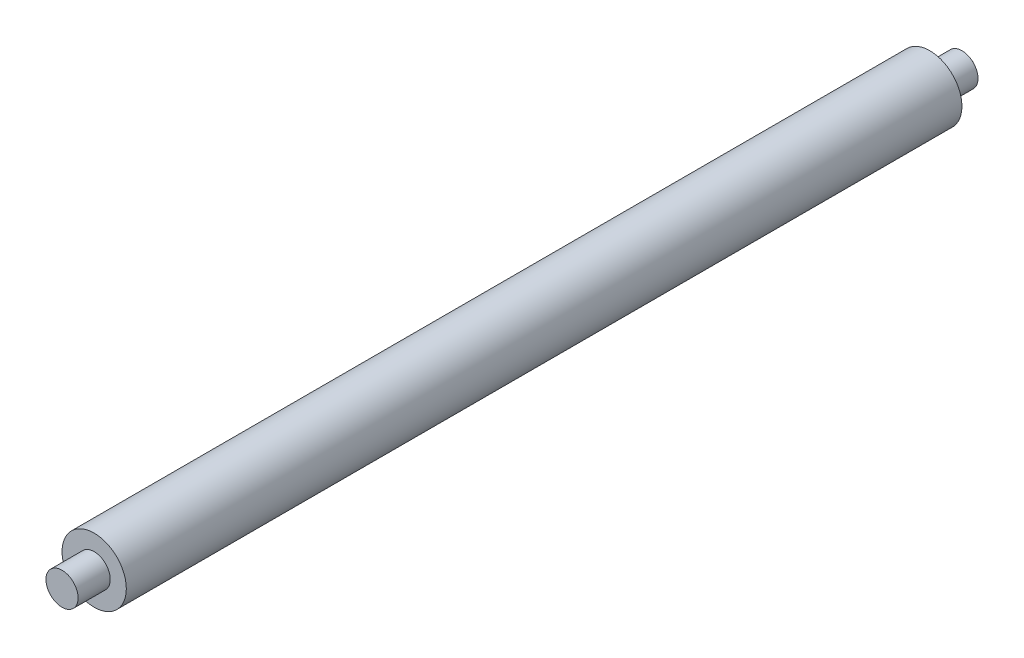
from build123d import *

# Parameters (mm, degrees)
SKETCH1_R           = 2.5
BOSS_EXTRUDE1_DEPTH = 5
SKETCH2_R           = 5
BOSS_EXTRUDE2_DEPTH = 130
SKETCH3_R           = 2.5
BOSS_EXTRUDE3_DEPTH = 5


with BuildPart() as part:
    # Sketch1 → Boss-Extrude1 (new body)
    with BuildSketch(Plane.XY):
        Circle(SKETCH1_R)
    extrude(amount=BOSS_EXTRUDE1_DEPTH)

    # Sketch2 → Boss-Extrude2 (add)
    with BuildSketch(Plane.XY.offset(5)):
        Circle(SKETCH2_R)
    extrude(amount=BOSS_EXTRUDE2_DEPTH)

    # Sketch3 → Boss-Extrude3 (add)
    with BuildSketch(Plane.XY.offset(135)):
        Circle(SKETCH3_R)
    extrude(amount=BOSS_EXTRUDE3_DEPTH)


solid = part.part
